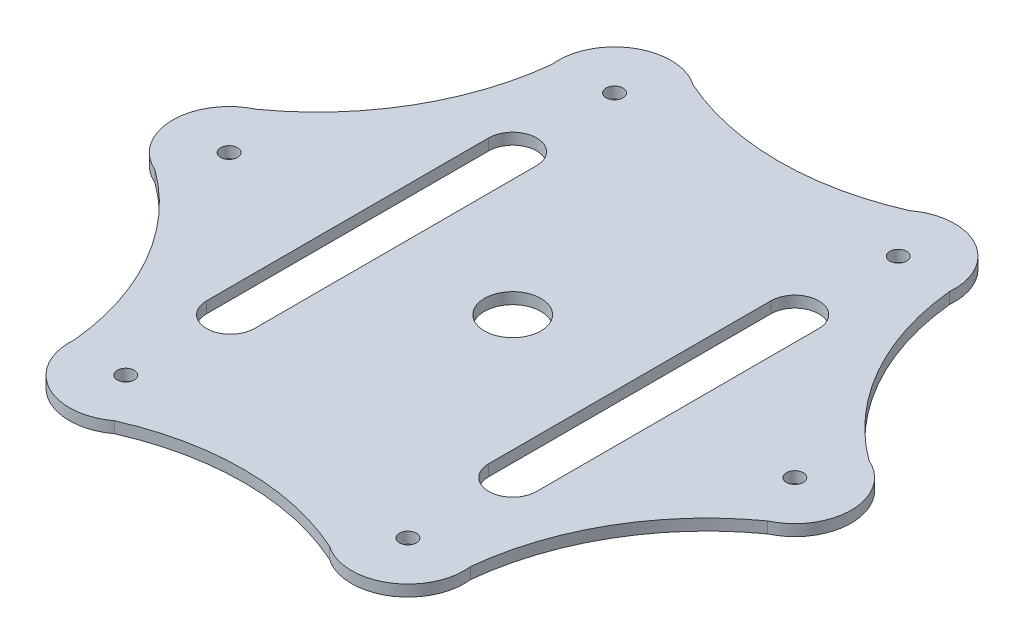
from build123d import *

# Parameters (mm, degrees)
SKETCH1_R           = 1.5
BOSS_EXTRUDE1_DEPTH = 2
CUT_EXTRUDE1_DEPTH  = 81.447719073
SKETCH3_R           = 5
CUT_EXTRUDE2_DEPTH  = 81.447719073


with BuildPart() as part:
    # Sketch1 → Boss-Extrude1 (new body)
    with BuildSketch(Plane(origin=(0, 0, 0), x_dir=(1, 0, 0), z_dir=(0, 1, 0))):
        with BuildLine():
            ThreePointArc((-34.963763955, -42.691134729), (-29.856641946, -52.293165337), (-19.005975188, -51.555115262))
            ThreePointArc((-19.005975188, -51.555115262), (0.154155805, -47.566469585), (19.272821809, -51.749354259))
            ThreePointArc((19.272821809, -51.749354259), (30.141985248, -52.127472163), (34.928148513, -42.361494065))
            ThreePointArc((34.928148513, -42.361494065), (41.005634123, -23.636153056), (54.236585765, -9.05821953))
            ThreePointArc((54.236585765, -9.05821953), (59.998627194, 0.165693174), (53.934123701, 9.193621197))
            ThreePointArc((53.934123701, 9.193621197), (41.034184142, 23.742001216), (35.148040543, 42.273518027))
            ThreePointArc((35.148040543, 42.273518027), (30.040918534, 51.875548635), (19.190251776, 51.13749856))
            ThreePointArc((19.190251776, 51.13749856), (-0.053987233, 47.109599988), (-19.274467503, 51.249387444))
            ThreePointArc((-19.274467503, 51.249387444), (-30.143630941, 51.627505348), (-34.929794206, 41.86152725))
            ThreePointArc((-34.929794206, 41.86152725), (-41.05559122, 23.274044232), (-54.237408611, 8.808236123))
            ThreePointArc((-54.237408611, 8.808236123), (-59.999450041, -0.415676581), (-53.934946548, -9.443604604))
            ThreePointArc((-53.934946548, -9.443604604), (-40.900612569, -24.042441945), (-34.963763955, -42.691134729))
        make_face()
        with Locations(Location((50, 0, 0), (0, 0, 90))):
            Circle(SKETCH1_R, mode=Mode.SUBTRACT)
        with Locations(Location((24.999177153, -43.551253597, 0), (0, 0, 90))):
            Circle(SKETCH1_R, mode=Mode.SUBTRACT)
        with Locations(Location((25.185099435, 43.133636895, 0), (0, 0, 90))):
            Circle(SKETCH1_R, mode=Mode.SUBTRACT)
        with Locations(Location((-25.000822847, -43.551253597, 0), (0, 0, 90))):
            Circle(SKETCH1_R, mode=Mode.SUBTRACT)
        with Locations(Location((-50.000822847, -0.249983407, 0), (0, 0, 90))):
            Circle(SKETCH1_R, mode=Mode.SUBTRACT)
        with Locations(Location((-25.000822847, 43.051286782, 0), (0, 0, 90))):
            Circle(SKETCH1_R, mode=Mode.SUBTRACT)
    extrude(amount=-BOSS_EXTRUDE1_DEPTH)

    # Sketch2 → Cut-Extrude1 (cut, through all)
    with BuildSketch(Plane(origin=(0, 0, 0), x_dir=(1, 0, 0), z_dir=(0, 1, 0))):
        with BuildLine():
            Line((-20.75, 25), (-20.75, -25))
            ThreePointArc((-20.75, -25), (-25, -29.25), (-29.25, -25))
            Line((-29.25, -25), (-29.25, 25))
            ThreePointArc((-29.25, 25), (-25, 29.25), (-20.75, 25))
        make_face()
        with BuildLine():
            Line((20.75, 25), (20.75, -25))
            ThreePointArc((20.75, -25), (25, -29.25), (29.25, -25))
            Line((29.25, -25), (29.25, 25))
            ThreePointArc((29.25, 25), (25, 29.25), (20.75, 25))
        make_face()
    extrude(amount=-CUT_EXTRUDE1_DEPTH, mode=Mode.SUBTRACT)

    # Sketch3 → Cut-Extrude2 (cut, through all)
    with BuildSketch(Plane(origin=(0, 0, 0), x_dir=(1, 0, 0), z_dir=(0, 1, 0))):
        with Locations(Location((0, 0, 0), (0, 0, 270))):
            Circle(SKETCH3_R)
    extrude(amount=-CUT_EXTRUDE2_DEPTH, mode=Mode.SUBTRACT)


solid = part.part
